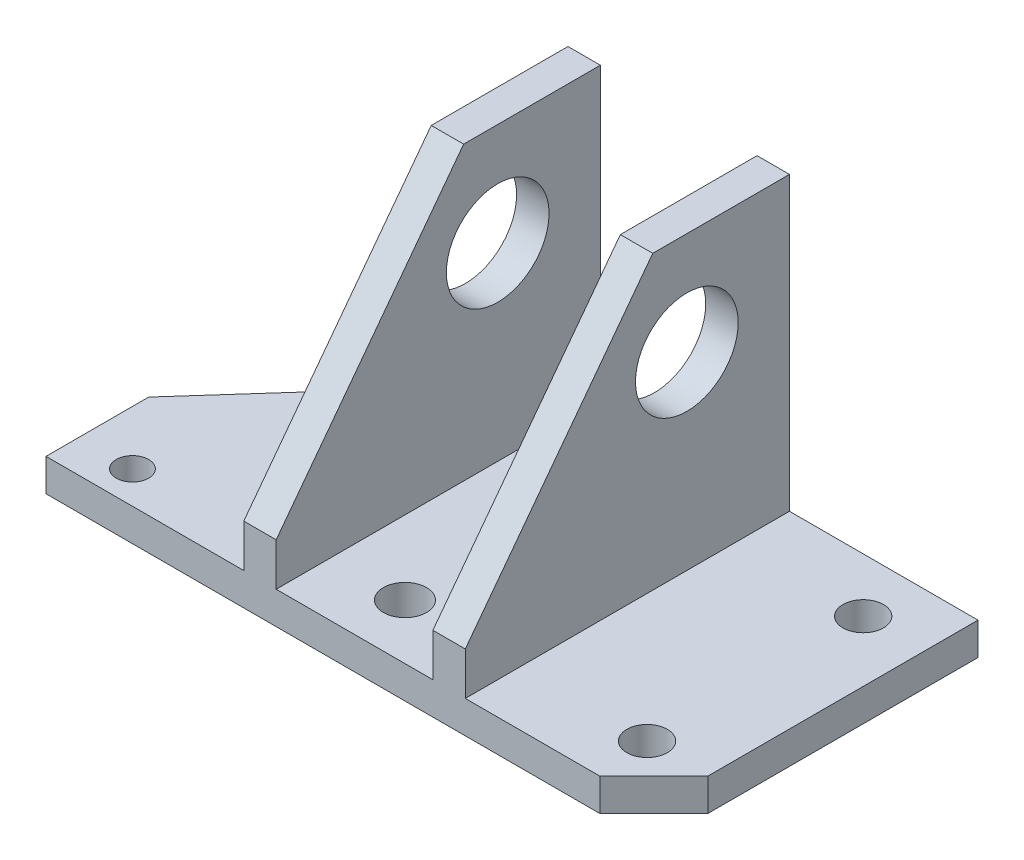
from build123d import *

# Parameters (mm, degrees)
BOSS_EXTRUDE1_DEPTH = 60
CUT_EXTRUDE1_DEPTH  = 120
CUT_EXTRUDE2_DEPTH  = 120
CUT_EXTRUDE3_DEPTH  = 60
SKETCH7_R           = 19
CUT_EXTRUDE4_DEPTH  = 60
SKETCH10_R          = 8
SKETCH10_R_2        = 7.507478142
SKETCH10_R_3        = 6
CUT_EXTRUDE5_DEPTH  = 120


with BuildPart() as part:
    # Sketch1 → Boss-Extrude1 (new, symmetric)
    with BuildSketch(Plane.XY):
        Polygon((-112.5, 0), (-112.5, -12), (112.5, -12), (112.5, 0), (42.711972594, 0), (42.711972594, 108), (30.711972594, 108), (30.711972594, 0), (-27.288027406, 0), (-27.288027406, 108), (-39.288027406, 108), (-39.288027406, 0), align=None)
    extrude(amount=BOSS_EXTRUDE1_DEPTH, both=True)

    # Sketch2 → Cut-Extrude1 (cut)
    with BuildSketch(Plane(origin=(0, 0, 0), x_dir=(1, 0, 0), z_dir=(0, 1, 0))):
        Polygon((112.5, -60), (112.5, -40.004428551), (92.5, -60), align=None)
    extrude(amount=-CUT_EXTRUDE1_DEPTH, mode=Mode.SUBTRACT)

    # Sketch3 → Cut-Extrude2 (cut)
    with BuildSketch(Plane(origin=(0, 0, 0), x_dir=(1, 0, 0), z_dir=(0, 1, 0))):
        Polygon((-39.288027406, 60), (-112.5, 60), (-112.5, -21.997416505), align=None)
    extrude(amount=-CUT_EXTRUDE2_DEPTH, mode=Mode.SUBTRACT)

    # Sketch5 → Cut-Extrude3 (cut, symmetric)
    with BuildSketch(Plane(origin=(0, 0, 0), x_dir=(0, 0, -1), z_dir=(1, 0, 0))):
        Polygon((9.388870173, 108), (-60, 108), (-60, 15.855119955), align=None)
    extrude(amount=CUT_EXTRUDE3_DEPTH, both=True, mode=Mode.SUBTRACT)

    # Sketch7 → Cut-Extrude4 (cut, symmetric)
    with BuildSketch(Plane(origin=(0, 0, 0), x_dir=(0, 0, -1), z_dir=(1, 0, 0))):
        with Locations(Location((22, 70, 0), (0, 0, 90))):
            Circle(SKETCH7_R)
    extrude(amount=CUT_EXTRUDE4_DEPTH, both=True, mode=Mode.SUBTRACT)

    # Sketch10 → Cut-Extrude5 (cut)
    with BuildSketch(Plane(origin=(0, 0, 0), x_dir=(1, 0, 0), z_dir=(0, 1, 0))):
        with Locations(Location((0, 39.625914849, 0), (0, 0, 270))):
            Circle(SKETCH10_R)
        with Locations(Location((90, -40, 0), (0, 0, 270))):
            Circle(SKETCH10_R_2)
        with Locations(Location((-92.5, -48, 0), (0, 0, 270))):
            Circle(SKETCH10_R_3)
        with Locations(Location((0, -39.625914849, 0), (0, 0, 180))):
            Circle(SKETCH10_R)
        with Locations(Location((90, 40, 0), (0, 0, 180))):
            Circle(SKETCH10_R_2)
    extrude(amount=-CUT_EXTRUDE5_DEPTH, mode=Mode.SUBTRACT)


solid = part.part
